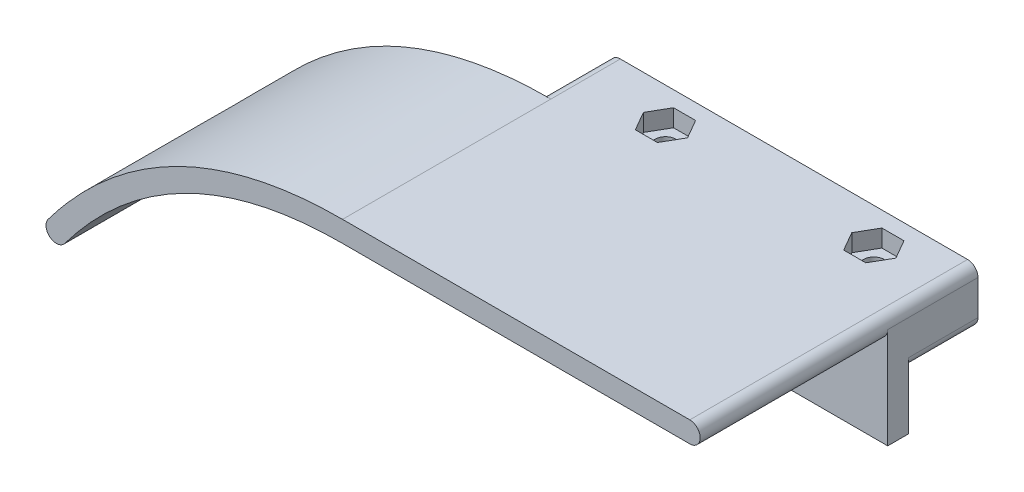
from build123d import *

# Parameters (mm, degrees)
EXTRUDE_1_DEPTH     = 30
EXTRUDE_2_DEPTH     = 3
EXTRUDE_START       = 10
EXTRUDE_3_DEPTH     = 10
SKETCH_4_R          = 1.5
CUT_EXTRUDE_1_DEPTH = 78.719045441
CUT_EXTRUDE_2_DEPTH = 78.27677545
CUT_EXTRUDE_START   = -2.5
CUT_EXTRUDE_3_DEPTH = 81.219045441
FILLET_1_R          = 2


with BuildPart() as part:
    # 草图1 → 凸台-拉伸1 (new body)
    with BuildSketch(Plane.XY):
        with BuildLine():
            Line((-25, -1.5), (25, -1.5))
            ThreePointArc((25, -1.5), (26.5, 0), (25, 1.5))
            Line((25, 1.5), (-25, 1.5))
            add(Edge.make_bspline(
                [(-25, 1.5), (-34.841235479, 1.511543442), (-49.008834865, -3.48233027), (-61.504493466, -11.820085551), (-67.4, -19.7)],
                knots=[0, 0, 0, 0.375, 0.625, 1, 1, 1], degree=2))
            ThreePointArc((-67.4, -19.7), (-67.1, -21.8), (-65, -21.5))
            add(Edge.make_bspline(
                [(-25, -1.5), (-50, -1.5), (-65, -21.5)],
                knots=[0, 0, 0, 1, 1, 1], degree=2))
        make_face()
    extrude(amount=EXTRUDE_1_DEPTH)

    # 草图2 → 凸台-拉伸2 (add)
    with BuildSketch(Plane(origin=(0, 0, 0), x_dir=(-1, 0, 0), z_dir=(0, 0, -1))):
        with BuildLine():
            Line((25, 1.5), (-25, 1.5))
            ThreePointArc((-25, 1.5), (-26.060660172, 1.060660172), (-26.5, 0))
            Line((-26.5, 0), (-26.5, -22.1))
            Line((-26.5, -22.1), (66.2, -22.1))
            ThreePointArc((66.2, -22.1), (67.541640786, -21.270820393), (67.4, -19.7))
            add(Edge.make_bspline(
                [(25, 1.5), (34.841235479, 1.511543442), (49.008834865, -3.48233027), (61.504493466, -11.820085551), (67.4, -19.7)],
                knots=[0, 0, 0, 0.375, 0.625, 1, 1, 1], degree=2))
        make_face()
    extrude(amount=-EXTRUDE_2_DEPTH)

    # 草图3 → 凸台-拉伸3 (add)
    with BuildSketch(Plane(origin=(0, 0, 0), x_dir=(-1, 0, 0), z_dir=(0, 0, -1)).offset(EXTRUDE_START)):
        with BuildLine():
            Line((-25, 1.5), (25, 1.5))
            ThreePointArc((25, 1.5), (26.060660172, 1.060660172), (26.5, 0))
            Line((26.5, 0), (26.5, -5))
            ThreePointArc((26.5, -5), (26.060660172, -6.060660172), (25, -6.5))
            Line((25, -6.5), (-25, -6.5))
            ThreePointArc((-25, -6.5), (-26.060660172, -6.060660172), (-26.5, -5))
            Line((-26.5, -5), (-26.5, 0))
            ThreePointArc((-26.5, 0), (-26.060660172, 1.060660172), (-25, 1.5))
        make_face()
    extrude(amount=-EXTRUDE_3_DEPTH)

    # 草图4 → 切除-拉伸1 (cut, through all)
    with BuildSketch(Plane(origin=(0, 1.5, 0), x_dir=(1, 0, 0), z_dir=(0, 1, 0))):
        with Locations(Location((-13.5, 5, 0), (0, 0, 270))):
            Circle(SKETCH_4_R)
        with Locations(Location((16.5, 5, 0), (0, 0, 270))):
            Circle(SKETCH_4_R)
    extrude(amount=-CUT_EXTRUDE_1_DEPTH, mode=Mode.SUBTRACT)

    # 草图5 → 切除-拉伸2 (cut, through all)
    with BuildSketch(Plane(origin=(0, 0, 0), x_dir=(-1, 0, 0), z_dir=(0, 0, -1))):
        with BuildLine():
            Line((-26.5, -14.5), (33.5, -14.5))
            ThreePointArc((33.5, -14.5), (38.874011537, -16.725988463), (41.1, -22.1))
            Line((41.1, -22.1), (-26.5, -22.1))
            Line((-26.5, -22.1), (-26.5, -14.5))
        make_face()
    extrude(amount=-CUT_EXTRUDE_2_DEPTH, mode=Mode.SUBTRACT)

    # 草图6 → 切除-拉伸3 (cut, through all)
    with BuildSketch(Plane(origin=(0, 1.5, 0), x_dir=(1, 0, 0), z_dir=(0, 1, 0)).offset(CUT_EXTRUDE_START)):
        Polygon((-11.91228676, 7.75), (-15.08771324, 7.75), (-16.675426481, 5), (-15.08771324, 2.25), (-11.91228676, 2.25), (-10.324573519, 5), align=None)
        Polygon((18.08771324, 7.75), (14.91228676, 7.75), (13.324573519, 5), (14.91228676, 2.25), (18.08771324, 2.25), (19.675426481, 5), align=None)
    extrude(amount=CUT_EXTRUDE_3_DEPTH, mode=Mode.SUBTRACT)

    # 圆角1
    fillet_1_edges = [part.edges().sort_by_distance(p)[0] for p in [
        (-41.1, -22.1, 1.5),
    ]]
    fillet(fillet_1_edges, radius=FILLET_1_R)


solid = part.part
